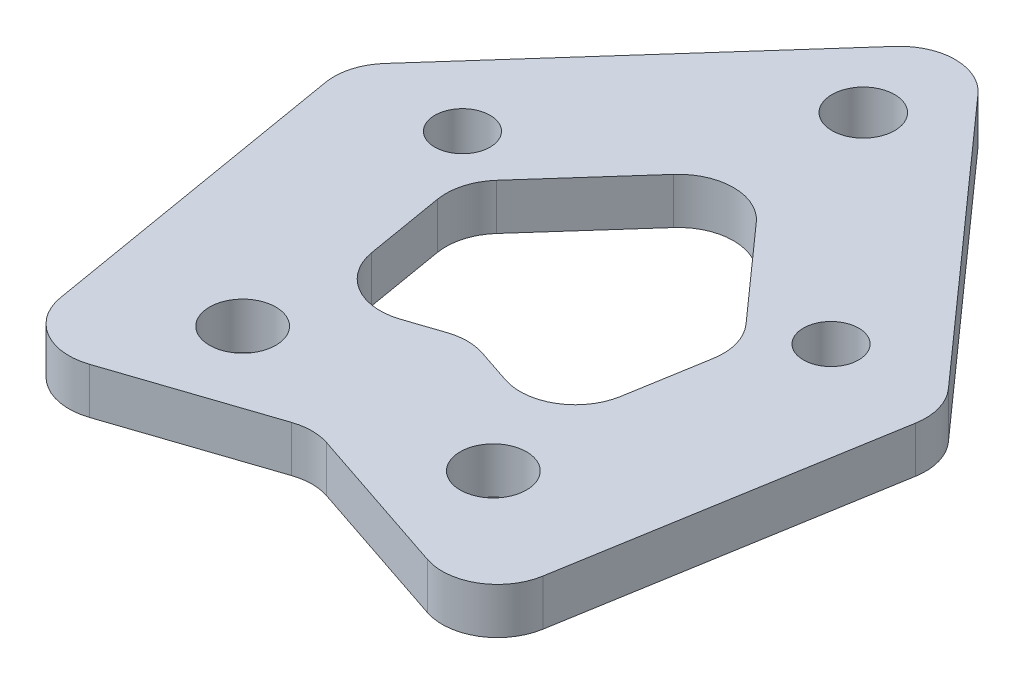
from build123d import *

# Parameters (mm, degrees)
BOSS_EXTRUDE1_DEPTH = 1.5875
SKETCH2_R           = 1.905000001
SKETCH2_R_2         = 1.905000002
SKETCH2_R_3         = 2.159000002
SKETCH2_R_4         = 2.286
CUT_EXTRUDE1_DEPTH  = 69.454207549
CUT_EXTRUDE3_DEPTH  = 69.454207549
FILLET2_R           = 3.81


with BuildPart() as part:
    # Sketch1 → Boss-Extrude1 (new, symmetric)
    with BuildSketch(Plane(origin=(0, 0, 0), x_dir=(1, 0, 0), z_dir=(0, 1, 0))):
        Polygon((11.747500001, 20.002499998), (32.385000001, 43.179999998), (53.022500001, 20.002499998), (48.260000001, -8.172829969), (32.385000001, -2.857500002), (16.510000001, -8.172829969), align=None)
    extrude(amount=BOSS_EXTRUDE1_DEPTH, both=True)

    # Sketch2 → Cut-Extrude1 (cut, through all)
    with BuildSketch(Plane(origin=(0, -1.5875, 0), x_dir=(1, 0, 0), z_dir=(0, 1, 0))):
        with Locations(Location((19.684999998, 20.002500002, 0), (0, 0, 270))):
            Circle(SKETCH2_R)
        with Locations(Location((45.084999998, 20.0025, 0), (0, 0, 270))):
            Circle(SKETCH2_R_2)
        with Locations(Location((32.385000001, 34.925000025, 0), (0, 0, 270))):
            Circle(SKETCH2_R_3)
        with Locations(Location((23.747482722, 0.795511849, 0), (0, 0, 270))):
            Circle(SKETCH2_R_4)
        with Locations(Location((41.022517279, 0.795511849, 0), (0, 0, 90))):
            Circle(SKETCH2_R_4)
    extrude(amount=CUT_EXTRUDE1_DEPTH, mode=Mode.SUBTRACT)

    # Sketch4 → Cut-Extrude3 (cut, through all)
    with BuildSketch(Plane(origin=(0, 1.5875, 0), x_dir=(1, 0, 0), z_dir=(0, 1, 0))):
        Polygon((22.578091019, 16.887859433), (24.548137073, 5.232909805), (32.385000001, 7.856879088), (40.221862929, 5.232909805), (42.191908982, 16.887859433), (32.385000001, 27.901772597), align=None)
    extrude(amount=-CUT_EXTRUDE3_DEPTH, mode=Mode.SUBTRACT)

    # Fillet2
    fillet2_edges = [part.edges().sort_by_distance(p)[0] for p in [
        (53.022500001, 0, -20.002499998),
        (48.260000001, 0, 8.172829969),
        (32.385000001, 0, 2.857500002),
        (16.510000001, 0, 8.172829969),
        (11.747500001, 0, -20.002499998),
        (32.385000001, 0, -43.179999998),
        (22.578091019, 0, -16.887859433),
        (32.385000001, 0, -27.901772597),
        (42.191908982, 0, -16.887859433),
        (40.221862929, 0, -5.232909805),
        (32.385000001, 0, -7.856879088),
        (24.548137073, 0, -5.232909805),
    ]]
    fillet(fillet2_edges, radius=FILLET2_R)


solid = part.part
